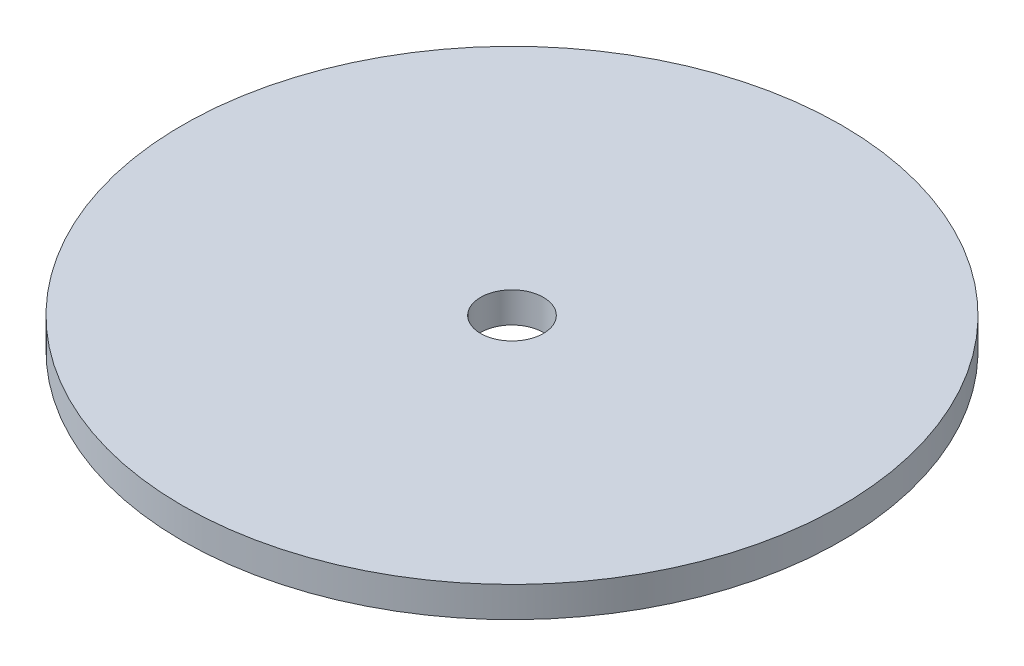
from build123d import *

# Parameters (mm, degrees)
SKETCH1_R               = 34.29
BOSS_EXTRUDE1_DEPTH     = 3.175
F_1_4_CLEARANCE_HOLE1_D = 6.5278


with BuildPart() as part:
    # Sketch1 → Boss-Extrude1 (new body)
    with BuildSketch(Plane(origin=(0, 0, 0), x_dir=(1, 0, 0), z_dir=(0, 1, 0))):
        with Locations(Location((0, 0, 0), (0, 0, 270))):
            Circle(SKETCH1_R)
    extrude(amount=BOSS_EXTRUDE1_DEPTH)

    # 1/4 Clearance Hole1 (through all)
    with Locations(Plane(origin=(0, 3.175, 0), x_dir=(1, 0, 0), z_dir=(0, 1, 0))):
        with Locations((0, 0)):
            Hole(F_1_4_CLEARANCE_HOLE1_D / 2)


solid = part.part
